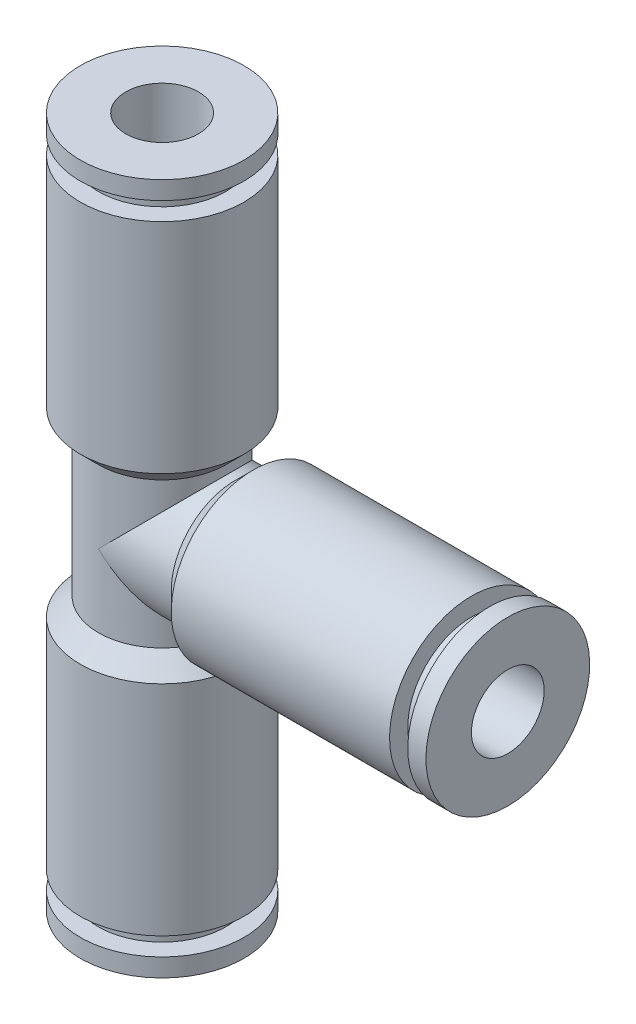
from build123d import *
from build123d.topology import SkipClean

# Parameters (mm, degrees)
PATTERN_CIRCULAR_1_COUNT = 3
PATTERN_CIRCULAR_1_ANGLE = 180


with BuildPart() as part:
    # Эскиз1 one side → Повернуть1 (revolve)
    with BuildSketch(Plane.XY, mode=Mode.PRIVATE) as revolve_1_sk:
        with BuildLine():
            Line((0, -3.5), (0, -2))
            ThreePointArc((0, -2), (-1.414213562, -1.414213562), (-2, 0))
            Line((-2, 0), (-2, 6))
            Line((-2, 6), (-2, 19))
            Line((-2, 19), (-4.5, 19))
            Line((-4.5, 19), (-4.5, 18))
            Line((-4.5, 18), (-3.5, 18))
            Line((-3.5, 18), (-3.5, 17))
            Line((-3.5, 17), (-4.5, 17))
            Line((-4.5, 17), (-4.5, 5))
            Line((-4.5, 5), (-3.5, 4))
            Line((-3.5, 4), (-3.5, 0))
            ThreePointArc((-3.5, 0), (-2.474873734, -2.474873734), (0, -3.5))
        make_face()
    revolve_1 = revolve(revolve_1_sk.sketch.rotate(Axis((0, 0.887308405, 0), (0, 1, 0)), 180), axis=Axis((0, 0.887308405, 0), (0, 1, 0)))

    # Круговой массив1: Повернуть1 ×3 about axis
    with SkipClean():  # the faces are left unmerged after this step: merging them gives an invalid solid
        pattern_circular_1_axis = Axis((0, 0, 0), (0, 0, -1))
        for i in range(1, PATTERN_CIRCULAR_1_COUNT):
            add(revolve_1.rotate(pattern_circular_1_axis, i * PATTERN_CIRCULAR_1_ANGLE / (PATTERN_CIRCULAR_1_COUNT - 1)))


solid = part.part
